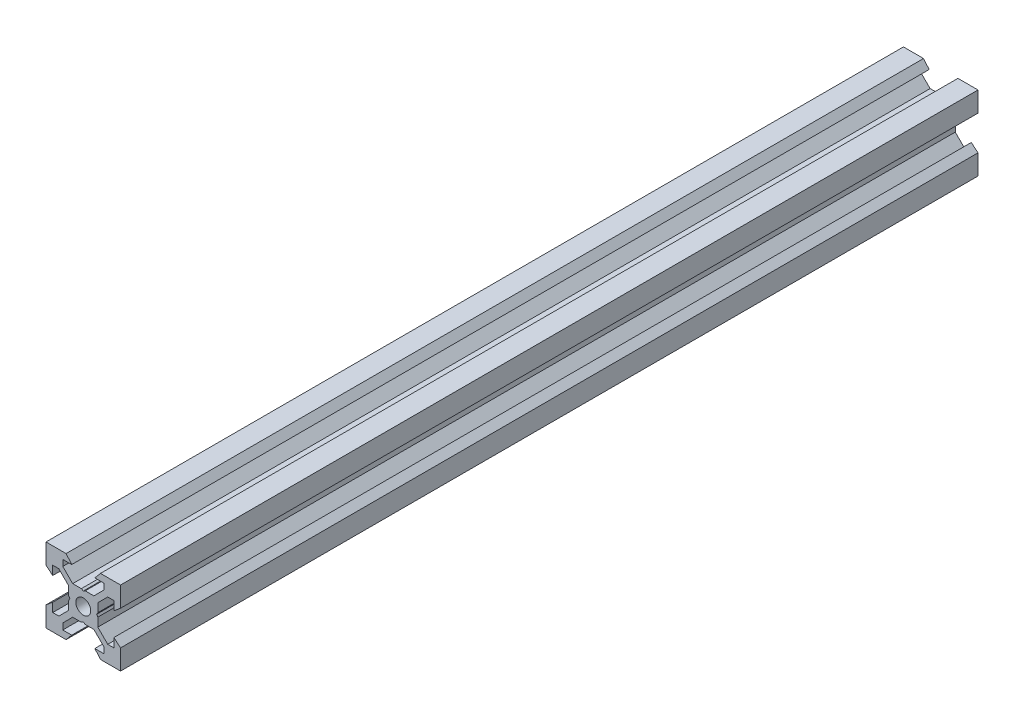
from build123d import *

# Parameters (mm, degrees)
SKETCH1_R           = 2
BOSS_EXTRUDE1_DEPTH = 115


with BuildPart() as part:
    # Sketch1 → Boss-Extrude1 (new, symmetric)
    with BuildSketch(Plane.XY):
        Polygon((10, 10), (10, 4.610379336), (8.2, 3.1), (8.2, 5.5), (6.560660172, 5.5), (3.9, 2.839339828), (3.9, 0.519615242), (3.6, 0), (3.9, -0.519615242), (3.9, -2.839339828), (6.560660172, -5.5), (8.2, -5.5), (8.2, -3.1), (10, -4.610379336), (10, -10), (4.610379336, -10), (3.1, -8.2), (5.5, -8.2), (5.5, -6.560660172), (2.839339828, -3.9), (0.519615242, -3.9), (0, -3.6), (-0.519615242, -3.9), (-2.839339828, -3.9), (-5.5, -6.560660172), (-5.5, -8.2), (-3.1, -8.2), (-4.610379336, -10), (-10, -10), (-10, -4.610379336), (-8.2, -3.1), (-8.2, -5.5), (-6.560660172, -5.5), (-3.9, -2.839339828), (-3.9, -0.519615242), (-3.6, 0), (-3.9, 0.519615242), (-3.9, 2.839339828), (-6.560660172, 5.5), (-8.2, 5.5), (-8.2, 3.1), (-10, 4.610379336), (-10, 10), (-4.610379336, 10), (-3.1, 8.2), (-5.5, 8.2), (-5.5, 6.560660172), (-2.839339828, 3.9), (-0.519615242, 3.9), (0, 3.6), (0.519615242, 3.9), (2.839339828, 3.9), (5.5, 6.560660172), (5.5, 8.2), (3.1, 8.2), (4.610379336, 10), align=None)
        Circle(SKETCH1_R, mode=Mode.SUBTRACT)
    extrude(amount=BOSS_EXTRUDE1_DEPTH, both=True)


solid = part.part
